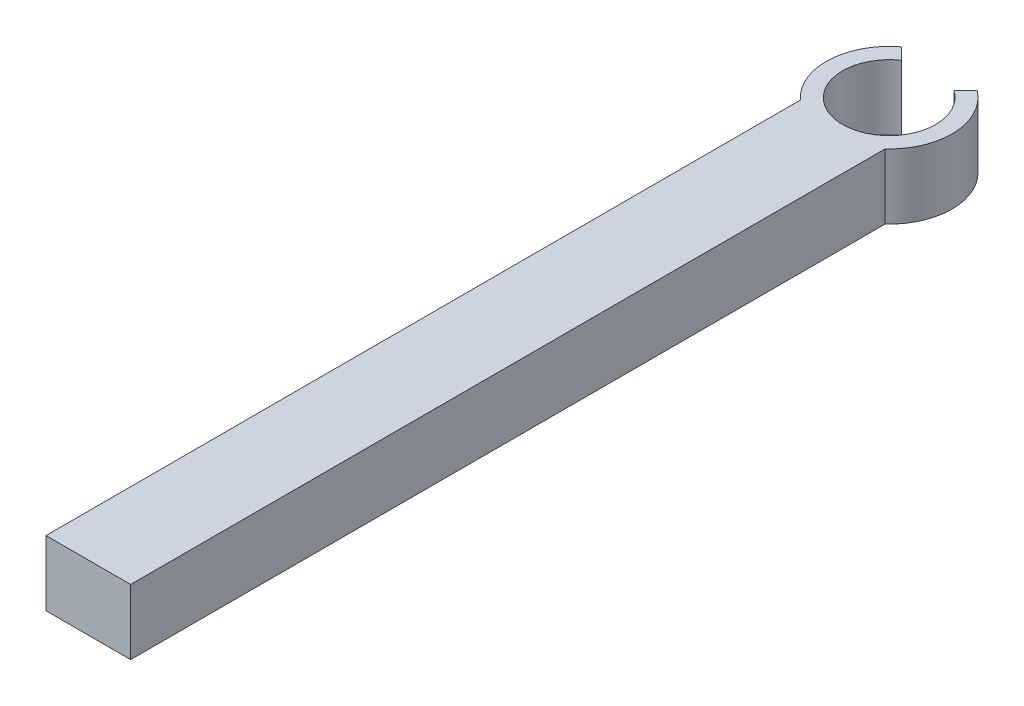
from build123d import *

# Parameters (mm, degrees)
SCHIZZO1_R                   = 7.15
ESTRUSIONE_ESTRUSIONE1_DEPTH = 10
TAGLIO_ESTRUSIONE1_DEPTH     = 85.287841486


with BuildPart() as part:
    # Schizzo1 → Estrusione-Estrusione1 (new body)
    with BuildSketch(Plane(origin=(0, 0, 0), x_dir=(1, 0, 0), z_dir=(0, 1, 0))):
        with BuildLine():
            Line((-11.796487194, 33.499091111), (-11.796487194, -82.347087033))
            Line((-11.796487194, -82.347087033), (1.203512806, -82.347087033))
            Line((1.203512806, -82.347087033), (1.203512806, 33.499091111))
            ThreePointArc((1.203512806, 33.499091111), (-5.296487194, 50.281587168), (-11.796487194, 33.499091111))
        make_face()
        with Locations((-5.296487194, 40.631587168)):
            Circle(SCHIZZO1_R, mode=Mode.SUBTRACT)
    extrude(amount=ESTRUSIONE_ESTRUSIONE1_DEPTH)

    # Schizzo2 → Taglio-Estrusione1 (cut, through all)
    with BuildSketch(Plane(origin=(0, 10, 0), x_dir=(1, 0, 0), z_dir=(0, 1, 0))):
        Polygon((-16.367555006, 53.62907886), (5.774580618, 53.62907886), (-1.296487194, 46.558011048), (-9.296487194, 46.558011048), align=None)
    extrude(amount=-TAGLIO_ESTRUSIONE1_DEPTH, mode=Mode.SUBTRACT)


solid = part.part
